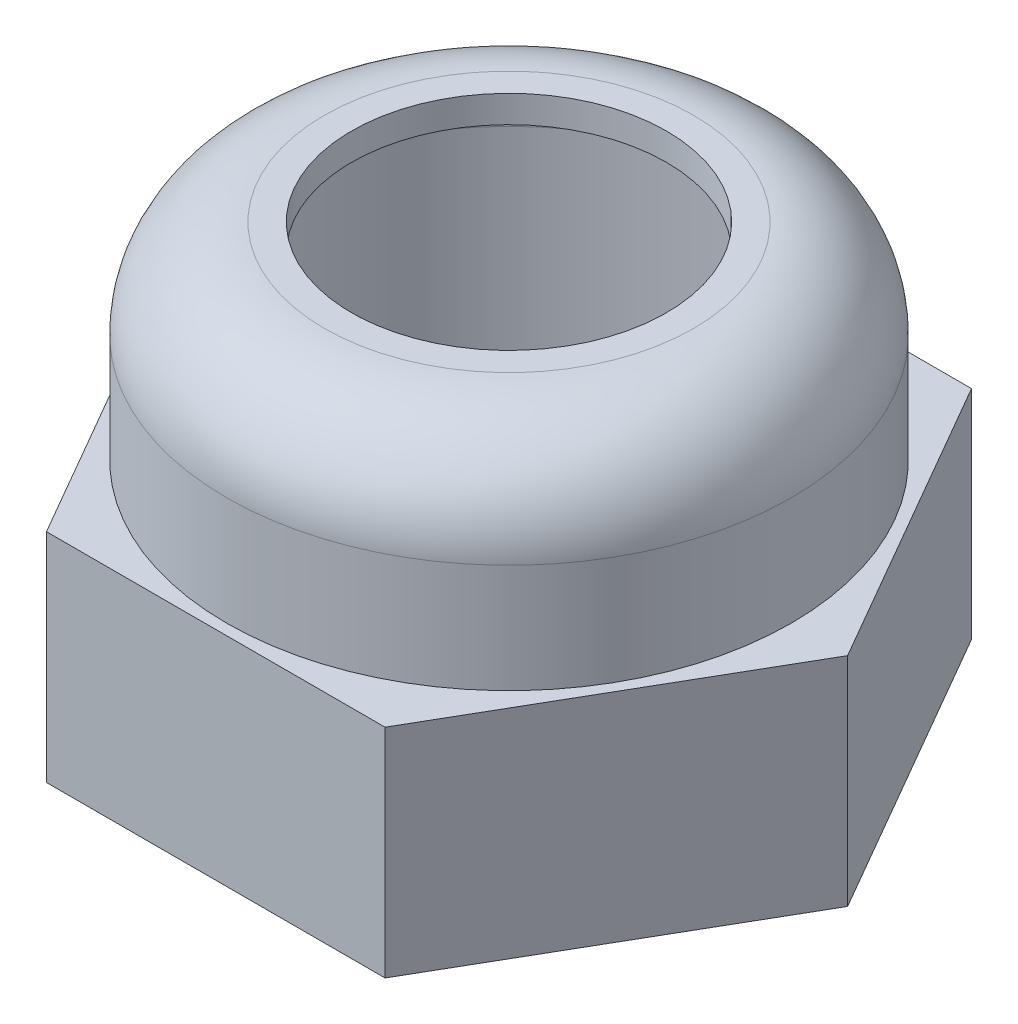
from build123d import *

# Parameters (mm, degrees)
SKIZZE1_R                       = 11.75
AUFSATZ_LINEAR_AUSTRAGEN1_DEPTH = 10
SKIZZE2_R                       = 13
SKIZZE2_R_2                     = 11.75
AUFSATZ_LINEAR_AUSTRAGEN2_DEPTH = 5


with BuildPart() as part:
    # Skizze1 → Aufsatz-Linear austragen1 (new body)
    with BuildSketch(Plane(origin=(0, 0, 0), x_dir=(1, 0, 0), z_dir=(0, 1, 0))):
        Polygon((15.588457268, 0), (7.794228634, 13.5), (-7.794228634, 13.5), (-15.588457268, 0), (-7.794228634, -13.5), (7.794228634, -13.5), align=None)
        with Locations(Location((0, 0, 0), (0, 0, 270))):
            Circle(SKIZZE1_R, mode=Mode.SUBTRACT)
    extrude(amount=AUFSATZ_LINEAR_AUSTRAGEN1_DEPTH)

    # Skizze2 → Aufsatz-Linear austragen2 (add)
    with BuildSketch(Plane(origin=(0, 10, 0), x_dir=(1, 0, 0), z_dir=(0, 1, 0))):
        with Locations(Location((0, 0, 0), (0, 0, 270))):
            Circle(SKIZZE2_R)
        with Locations(Location((0, 0, 0), (0, 0, 270))):
            Circle(SKIZZE2_R_2, mode=Mode.SUBTRACT)
    extrude(amount=AUFSATZ_LINEAR_AUSTRAGEN2_DEPTH)

    # Skizze3 → Rotation1 (revolve)
    with BuildSketch(Plane.XY, mode=Mode.PRIVATE) as rotation1_sk:
        with BuildLine():
            Line((-13, 15), (-11.75, 15))
            ThreePointArc((-11.75, 15), (-10.798097039, 17.298097039), (-8.5, 18.25))
            Line((-8.5, 18.25), (-7.25, 18.25))
            Line((-7.25, 18.25), (-7.25, 19.5))
            Line((-7.25, 19.5), (-8.5, 19.5))
            ThreePointArc((-8.5, 19.5), (-11.681980515, 18.181980515), (-13, 15))
        make_face()
    revolve(rotation1_sk.sketch.rotate(Axis((0, 0, 0), (0, 1, 0)), 270), axis=Axis((0, 0, 0), (0, 1, 0)))


solid = part.part
